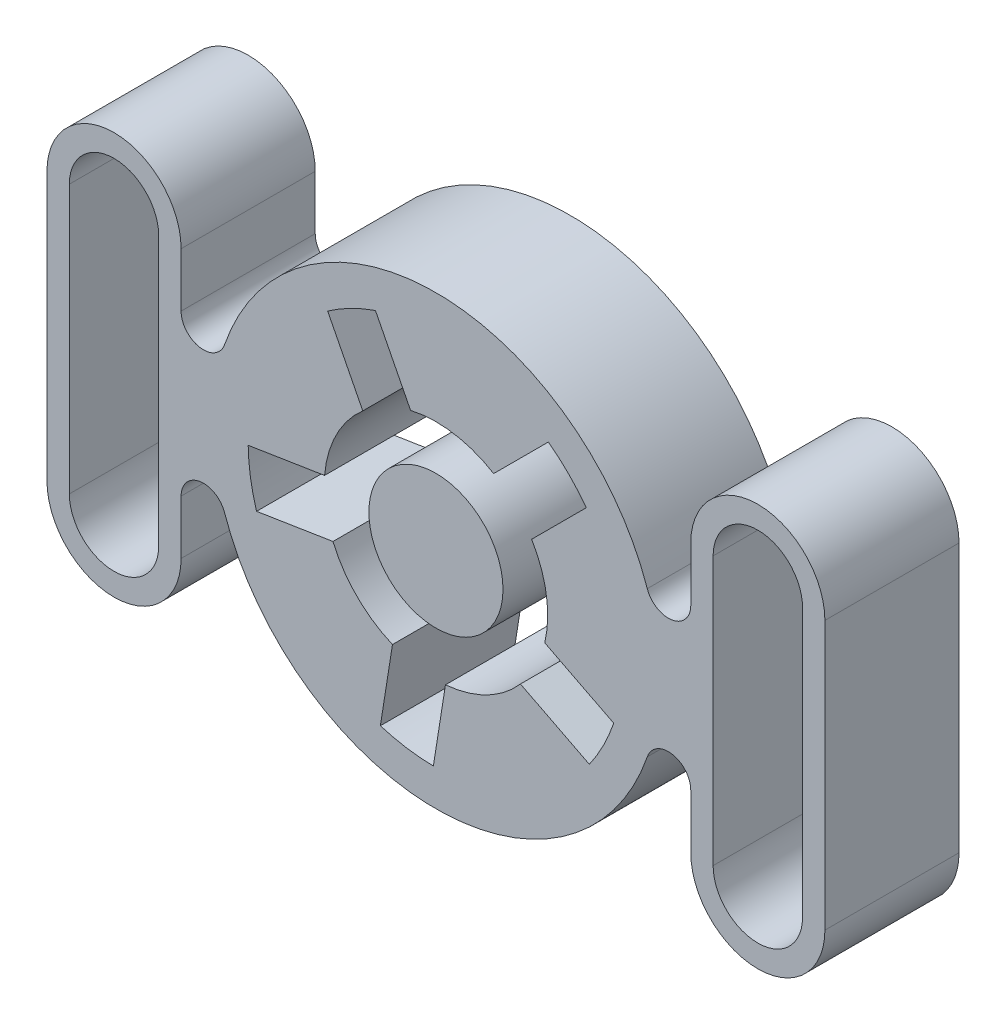
from build123d import *

# Parameters (mm, degrees)
SKETCH1_R           = 15
BOSS_EXTRUDE1_DEPTH = 15
BOSS_EXTRUDE2_DEPTH = 15
BOSS_EXTRUDE3_DEPTH = 15


with BuildPart() as part:
    # Sketch1 → Boss-Extrude1 (new, symmetric)
    with BuildSketch(Plane.XY):
        Circle(SKETCH1_R)
    extrude(amount=BOSS_EXTRUDE1_DEPTH, both=True)


with BuildPart() as body_2:
    # Sketch1<3> → Boss-Extrude2 (new, symmetric)
    with BuildSketch(Plane.XY):
        with BuildLine():
            Line((57, -17.916472867), (57, 17.916472867))
            ThreePointArc((57, 17.916472867), (52.825722824, 12.985126011), (47.272727273, 16.287702607))
            ThreePointArc((47.272727273, 16.287702607), (0, 50), (-47.272727273, 16.287702607))
            ThreePointArc((-47.272727273, 16.287702607), (-52.825722824, 12.985126011), (-57, 17.916472867))
            Line((-57, 17.916472867), (-57, -17.916472867))
            ThreePointArc((-57, -17.916472867), (-52.825722824, -12.985126011), (-47.272727273, -16.287702607))
            ThreePointArc((-47.272727273, -16.287702607), (0, -50), (47.272727273, -16.287702607))
            ThreePointArc((47.272727273, -16.287702607), (52.825722824, -12.985126011), (57, -17.916472867))
        make_face()
        with BuildLine():
            ThreePointArc((-5.672002568, 24.348067415), (3.910861626, 24.692208515), (12.918361615, 21.403642989))
            Line((12.918361615, 21.403642989), (25.151236226, 33.636517601))
            ThreePointArc((25.151236226, 33.636517601), (29.69848481, 29.69848481), (33.636517601, 25.151236226))
            Line((33.636517601, 25.151236226), (21.403642989, 12.918361615))
            ThreePointArc((21.403642989, 12.918361615), (24.692208515, 3.910861626), (24.348067415, -5.672002568))
            Line((24.348067415, -5.672002568), (39.762388673, -13.525991536))
            ThreePointArc((39.762388673, -13.525991536), (37.422274016, -19.067600989), (34.314502676, -24.218069826))
            Line((34.314502676, -24.218069826), (18.900181419, -16.364080859))
            ThreePointArc((18.900181419, -16.364080859), (11.349762493, -22.275163105), (2.129571608, -24.90913336))
            Line((2.129571608, -24.90913336), (-0.576728553, -41.996040101))
            ThreePointArc((-0.576728553, -41.996040101), (-6.570247532, -41.482910305), (-12.42898864, -40.118826521))
            Line((-12.42898864, -40.118826521), (-9.722688479, -23.03191978))
            ThreePointArc((-9.722688479, -23.03191978), (-17.67766953, -17.67766953), (-23.03191978, -9.722688479))
            Line((-23.03191978, -9.722688479), (-40.118826521, -12.42898864))
            ThreePointArc((-40.118826521, -12.42898864), (-41.482910305, -6.570247532), (-41.996040101, -0.576728553))
            Line((-41.996040101, -0.576728553), (-24.90913336, 2.129571608))
            ThreePointArc((-24.90913336, 2.129571608), (-22.275163105, 11.349762493), (-16.364080859, 18.900181419))
            Line((-16.364080859, 18.900181419), (-24.218069826, 34.314502676))
            ThreePointArc((-24.218069826, 34.314502676), (-19.067600989, 37.422274016), (-13.525991536, 39.762388673))
            Line((-13.525991536, 39.762388673), (-5.672002568, 24.348067415))
        make_face(mode=Mode.SUBTRACT)
    extrude(amount=BOSS_EXTRUDE2_DEPTH, both=True)

    # Sketch1<4> → Boss-Extrude3 (add, symmetric)
    # profile 1 of 2: a face of its own
    with BuildSketch(Plane.XY):
        with BuildLine():
            Line((87, -30), (87, 30))
            ThreePointArc((87, 30), (72, 45), (57, 30))
            Line((57, 30), (57, -30))
            ThreePointArc((57, -30), (72, -45), (87, -30))
        make_face()
        with BuildLine():
            ThreePointArc((62, 30), (72, 40), (82, 30))
            Line((82, 30), (82, -30))
            ThreePointArc((82, -30), (72, -40), (62, -30))
            Line((62, -30), (62, 30))
        make_face(mode=Mode.SUBTRACT)
    # profile 2 of 2: a face of its own
    with BuildSketch(Plane.XY):
        with BuildLine():
            Line((-57, -30), (-57, 30))
            ThreePointArc((-57, 30), (-72, 45), (-87, 30))
            Line((-87, 30), (-87, -30))
            ThreePointArc((-87, -30), (-72, -45), (-57, -30))
        make_face()
        with BuildLine():
            Line((-82, -30), (-82, 30))
            ThreePointArc((-82, 30), (-72, 40), (-62, 30))
            Line((-62, 30), (-62, -30))
            ThreePointArc((-62, -30), (-72, -40), (-82, -30))
        make_face(mode=Mode.SUBTRACT)
    extrude(amount=BOSS_EXTRUDE3_DEPTH, both=True)


solid = Compound([part.part, body_2.part])
